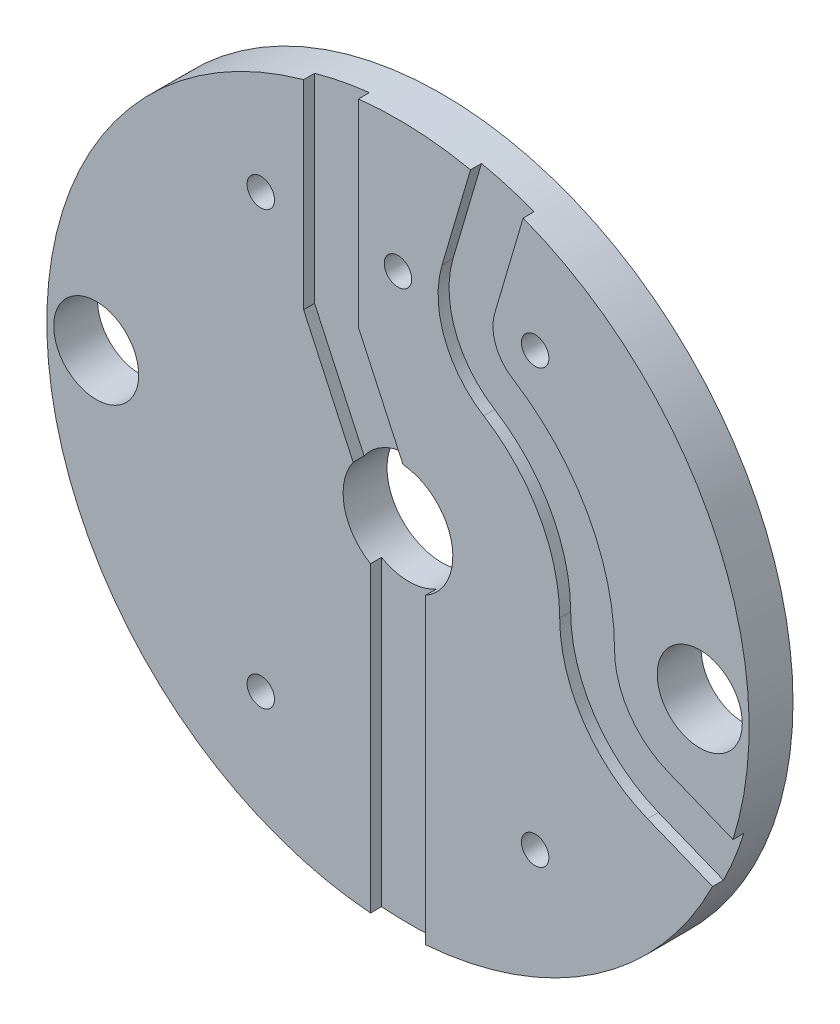
from build123d import *

# Parameters (mm, degrees)
ESQUISSE1_R             = 12.8
ESQUISSE1_R_2           = 2
ESQUISSE1_R_3           = 1.55
BOSS_EXTRU_1_DEPTH      = 1.6
ESQUISSE2_R             = 0.5
ENL_V_MAT_EXTRU_1_DEPTH = 19.172506707
ENL_V_MAT_EXTRU_2_DEPTH = 0.4


with BuildPart() as part:
    # Esquisse1 → Boss.-Extru.1 (new body)
    with BuildSketch(Plane.XY):
        Circle(ESQUISSE1_R)
        Circle(ESQUISSE1_R_2, mode=Mode.SUBTRACT)
        with Locations((-11, 0)):
            Circle(ESQUISSE1_R_3, mode=Mode.SUBTRACT)
        with Locations((11, 0)):
            Circle(ESQUISSE1_R_3, mode=Mode.SUBTRACT)
    extrude(amount=BOSS_EXTRU_1_DEPTH)

    # Esquisse2 → Enlèv. mat.-Extru.1 (cut, through all)
    with BuildSketch(Plane.XY.offset(1.6)):
        with Locations((5, -7.765166341)):
            Circle(ESQUISSE2_R)
        with Locations((-5, -7.765166341)):
            Circle(ESQUISSE2_R)
        with Locations((0, 7.998956295)):
            Circle(ESQUISSE2_R)
        with Locations((5, 7.998956295)):
            Circle(ESQUISSE2_R)
        with Locations((-5, 7.998956295)):
            Circle(ESQUISSE2_R)
    extrude(amount=-ENL_V_MAT_EXTRU_1_DEPTH, mode=Mode.SUBTRACT)

    # Esquisse4 → Enlèv. mat.-Extru.2 (cut)
    with BuildSketch(Plane.XY.offset(1.6)):
        with BuildLine():
            Line((2.849870715, 13.22379947), (4.768486358, 12.659074744))
            Line((4.768486358, 12.659074744), (3.524647017, 8.433211229))
            ThreePointArc((3.524647017, 8.433211229), (3.562251348, 7.452950263), (4.184819655, 6.694837904))
            ThreePointArc((4.184819655, 6.694837904), (6.905555582, 3.827123228), (7.895161183, 0))
            ThreePointArc((7.895161183, 0), (8.427320022, -1.738200739), (9.8413761, -2.88055806))
            Line((9.8413761, -2.88055806), (13.173167165, -4.220677813))
            Line((13.173167165, -4.220677813), (12.426832835, -6.076206058))
            Line((12.426832835, -6.076206058), (9.09504177, -4.736086305))
            ThreePointArc((9.09504177, -4.736086305), (6.770113236, -2.857872865), (5.895161183, 0))
            ThreePointArc((5.895161183, 0), (5.156242193, 2.857637453), (3.124722322, 4.998903458))
            ThreePointArc((3.124722322, 4.998903458), (1.692538076, 6.742899364), (1.606031374, 8.997935955))
            Line((1.606031374, 8.997935955), (2.849870715, 13.22379947))
        make_face()
        Polygon((-3.439832578, 13.22379947), (-1.439832578, 13.22379947), (-1.439832578, 5.505940762), (1, 0.219636844), (1, -13.772678102), (-1, -13.772678102), (-1, -0.219636844), (-3.439832578, 5.066667074), align=None)
    extrude(amount=-ENL_V_MAT_EXTRU_2_DEPTH, mode=Mode.SUBTRACT)


solid = part.part
